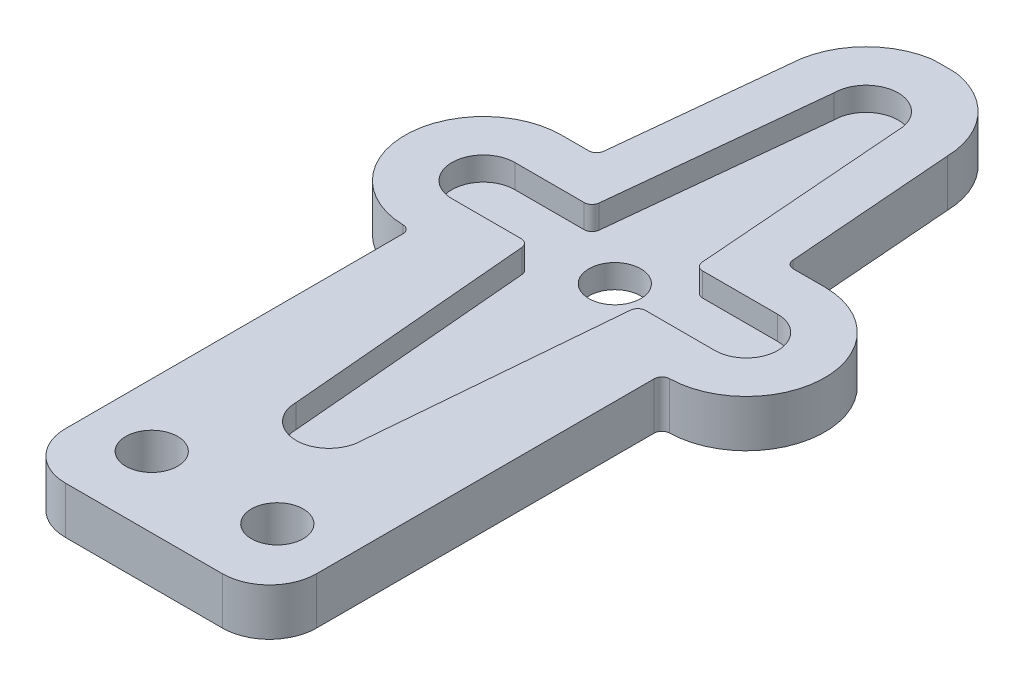
from build123d import *

# Parameters (mm, degrees)
SKETCH1_R               = 21
BOSS_EXTRUDE1_DEPTH     = 1.5
SKETCH5_W               = 16
SKETCH5_H               = 30
BOSS_EXTRUDE2_DEPTH     = 1.5
CUT_EXTRUDE1_DEPTH      = 1.5
CUT_EXTRUDE4_REACH      = 38.65
SKETCH4_R               = 1.65
CUT_EXTRUDE5_REACH      = 38.742
SKETCH6_R               = 1.65
CUT_EXTRUDE6_DEPTH      = 37.650375169
CUT_EXTRUDE6_DEPTH_BACK = 37.650375169
FILLET3_R               = 0.5
FILLET4_R               = 3


with BuildPart() as part:
    # Sketch1 → Boss-Extrude1 (new, symmetric)
    with BuildSketch(Plane(origin=(0, 0, 0), x_dir=(1, 0, 0), z_dir=(0, 1, 0))):
        with Locations(Location((0, 0, 0), (0, 0, 270))):
            Circle(SKETCH1_R)
    extrude(amount=BOSS_EXTRUDE1_DEPTH, both=True)

    # Sketch5 → Boss-Extrude2 (add, symmetric)
    with BuildSketch(Plane(origin=(0, 0, 0), x_dir=(1, 0, 0), z_dir=(0, 1, 0))):
        with Locations((0, -15)):
            Rectangle(SKETCH5_W, SKETCH5_H)
    extrude(amount=BOSS_EXTRUDE2_DEPTH, both=True)

    # Sketch2 → Cut-Extrude1 (cut)
    with BuildSketch(Plane(origin=(0, 1.5, 0), x_dir=(1, 0, 0), z_dir=(0, 1, 0))):
        with BuildLine():
            Line((-3.5, -2), (-2.1, -18.2))
            ThreePointArc((-2.1, -18.2), (0, -20.3), (2.1, -18.2))
            Line((2.1, -18.2), (3.5, -2))
            Line((3.5, -2), (8.375, -2))
            ThreePointArc((8.375, -2), (10.375, 0), (8.375, 2))
            Line((8.375, 2), (3.13, 2))
            Line((3.13, 2), (2.05, 16))
            ThreePointArc((2.05, 16), (0, 18.05), (-2.05, 16))
            Line((-2.05, 16), (-3.5, 2))
            Line((-3.5, 2), (-8.375, 2))
            ThreePointArc((-8.375, 2), (-10.375, 0), (-8.375, -2))
            Line((-8.375, -2), (-3.5, -2))
        make_face()
    extrude(amount=-CUT_EXTRUDE1_DEPTH, mode=Mode.SUBTRACT)

    # Sketch4 → Cut-Extrude4 (cut, up to next)
    with BuildSketch(Plane(origin=(0, 0, 0), x_dir=(1, 0, 0), z_dir=(0, 1, 0)), mode=Mode.PRIVATE) as cut_extrude4_sk1:
        with Locations(Location((0, 0, 0), (0, 0, 270))):
            Circle(SKETCH4_R)
    cut_extrude4_tool1 = extrude(cut_extrude4_sk1.sketch, amount=-CUT_EXTRUDE4_REACH, mode=Mode.PRIVATE) & part.part
    add(cut_extrude4_tool1.solids().sort_by_distance((0, 0, 0))[0], mode=Mode.SUBTRACT)

    # Sketch6 → Cut-Extrude5 (cut, up to next)
    with BuildSketch(Plane(origin=(0, 1.5, 0), x_dir=(1, 0, 0), z_dir=(0, 1, 0)), mode=Mode.PRIVATE) as cut_extrude5_sk1:
        with Locations(Location((4, -25.5, 0), (0, 0, 270))):
            Circle(SKETCH6_R)
    cut_extrude5_tool1 = extrude(cut_extrude5_sk1.sketch, amount=-CUT_EXTRUDE5_REACH, mode=Mode.PRIVATE) & part.part
    # Sketch6 → Cut-Extrude5 (cut, up to next)
    with BuildSketch(Plane(origin=(0, 1.5, 0), x_dir=(1, 0, 0), z_dir=(0, 1, 0)), mode=Mode.PRIVATE) as cut_extrude5_sk2:
        with Locations(Location((-4, -25.5, 0), (0, 0, 270))):
            Circle(SKETCH6_R)
    cut_extrude5_tool2 = extrude(cut_extrude5_sk2.sketch, amount=-CUT_EXTRUDE5_REACH, mode=Mode.PRIVATE) & part.part
    add(cut_extrude5_tool1.solids().sort_by_distance((4, 1.5, 25.5))[0], mode=Mode.SUBTRACT)
    add(cut_extrude5_tool2.solids().sort_by_distance((-4, 1.5, 25.5))[0], mode=Mode.SUBTRACT)

    # Sketch7 → Cut-Extrude6 (cut, two sides: drawn at the far end of the back side and taken through both)
    with BuildSketch(Plane(origin=(0, 0, 0), x_dir=(1, 0, 0), z_dir=(0, 1, 0)).offset(-CUT_EXTRUDE6_DEPTH_BACK)):
        with BuildLine():
            ThreePointArc((-0.811963461, 20.984296875), (-20.675312002, 3.678515137), (-8, -19.416487839))
            Line((-8, -19.416487839), (-8, -5))
            Line((-8, -5), (-8.375, -5))
            ThreePointArc((-8.375, -5), (-13.375, 0), (-8.375, 5))
            Line((-8.375, 5), (-6.205333354, 5))
            Line((-6.205333354, 5), (-5.046456013, 16.189160538))
            ThreePointArc((-5.046456013, 16.189160538), (-3.785314096, 19.342737979), (-0.811963461, 20.984296875))
        make_face()
        with BuildLine():
            ThreePointArc((8, -19.416487839), (20.675312002, 3.678515137), (0.811963461, 20.984296875))
            ThreePointArc((0.811963461, 20.984296875), (3.801185846, 19.324678355), (5.048028391, 16.141100531))
            Line((5.048028391, 16.141100531), (5.907484718, 5))
            Line((5.907484718, 5), (8.375, 5))
            ThreePointArc((8.375, 5), (13.375, 0), (8.375, -5))
            Line((8.375, -5), (8, -5))
            Line((8, -5), (8, -19.416487839))
        make_face()
    extrude(amount=CUT_EXTRUDE6_DEPTH + CUT_EXTRUDE6_DEPTH_BACK, mode=Mode.SUBTRACT)

    # Fillet3
    fillet3_edges = [part.edges().sort_by_distance(p)[0] for p in [
        (-8, 0, 5),
        (8, 0, 5),
        (-3.5, 0.75, -2),
        (3.5, 0.75, 2),
        (3.13, 0.75, -2),
        (-3.5, 0.75, 2),
        (-6.205333354, 0, -5),
        (5.907484718, 0, -5),
    ]]
    fillet(fillet3_edges, radius=FILLET3_R)

    # Fillet4
    fillet4_edges = [part.edges().sort_by_distance(p)[0] for p in [
        (8, 0, 30),
        (-8, 0, 30),
    ]]
    fillet(fillet4_edges, radius=FILLET4_R)


solid = part.part
